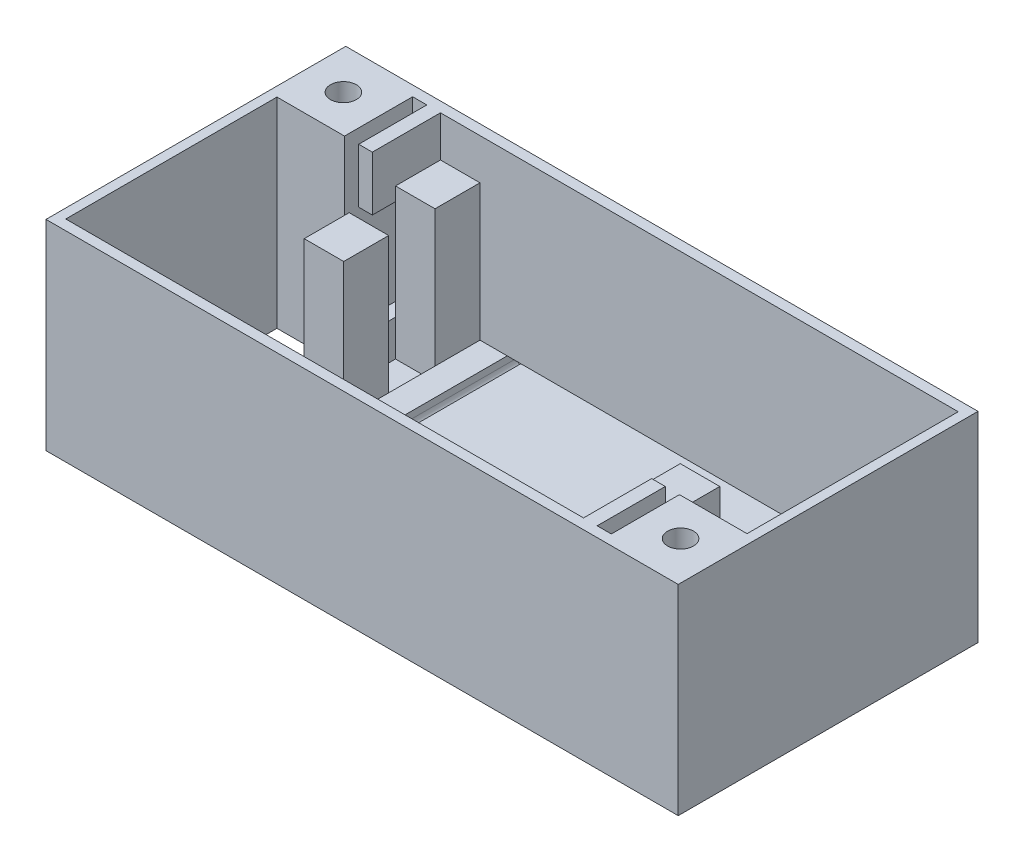
from build123d import *

# Parameters (mm, degrees)
ESBO_O1_W                = 46.4
ESBO_O1_H                = 22
ESBO_O1_W_2              = 45
ESBO_O1_H_2              = 20.5
RESSALTO_EXTRUS_O1_DEPTH = 14
ESBO_O2_W                = 46.4
ESBO_O2_H                = 22
RESSALTO_EXTRUS_O2_DEPTH = 0.7
ESBO_O3_W                = 2.9
ESBO_O3_H                = 3.3
RESSALTO_EXTRUS_O3_DEPTH = 11
ESBO_O4_W                = 4.95750459
ESBO_O4_H                = 14
ESBO_O4_W_2              = 1
ESBO_O4_H_2              = 2.660947199
ESBO_O4_H_3              = 4
RESSALTO_EXTRUS_O4_DEPTH = 5
ESBO_O5_W                = 1
ESBO_O5_H                = 2.660947199
ESBO_O5_W_2              = 4.96
ESBO_O5_H_2              = 14
RESSALTO_EXTRUS_O5_DEPTH = 5
RESSALTO_EXTRUS_O9_DEPTH = 1
ESBO_O15_W               = 4.95750459
ESBO_O15_H               = 5
ESBO_O15_W_2             = 4.96
CORTE_EXTRUS_O3_DEPTH    = 2.5
ESBO_O16_R               = 0.95
CORTE_EXTRUS_O4_DEPTH    = 4
CORTE_EXTRUS_O7_DEPTH    = 11
CORTE_EXTRUS_O8_DEPTH    = 11
CORTE_EXTRUS_O9_START    = -4
ESBO_O20_R               = 0.95
CORTE_EXTRUS_O9_DEPTH    = 4


with BuildPart() as part:
    # Esboço1 → Ressalto-extrusão1 (new body)
    with BuildSketch(Plane(origin=(0, 0, 0), x_dir=(1, 0, 0), z_dir=(0, 1, 0))):
        Rectangle(ESBO_O1_W, ESBO_O1_H)
        Rectangle(ESBO_O1_W_2, ESBO_O1_H_2, mode=Mode.SUBTRACT)
    extrude(amount=RESSALTO_EXTRUS_O1_DEPTH)

    # Esboço2 → Ressalto-extrusão2 (add)
    with BuildSketch(Plane(origin=(0, 0, 0), x_dir=(1, 0, 0), z_dir=(0, 1, 0))):
        Rectangle(ESBO_O2_W, ESBO_O2_H)
    extrude(amount=-RESSALTO_EXTRUS_O2_DEPTH)

    # Esboço3 → Ressalto-extrusão3 (add)
    with BuildSketch(Plane(origin=(0, 0, 0), x_dir=(1, 0, 0), z_dir=(0, 1, 0))):
        with Locations((-14.05, 1.9)):
            Rectangle(ESBO_O3_W, ESBO_O3_H)
        with Locations((-14.05, 8.6)):
            Rectangle(ESBO_O3_W, ESBO_O3_H)
        with Locations((14.05, -8.6)):
            Rectangle(ESBO_O3_W, ESBO_O3_H)
        with Locations((14.05, -1.9)):
            Rectangle(ESBO_O3_W, ESBO_O3_H)
    extrude(amount=RESSALTO_EXTRUS_O3_DEPTH)

    # Esboço4 → Ressalto-extrusão4 (add)
    with BuildSketch(Plane.XY.offset(-10.25)):
        with Locations((-20.021247705, 7)):
            Rectangle(ESBO_O4_W, ESBO_O4_H)
        with Locations((-16, 1.3304736)):
            Rectangle(ESBO_O4_W_2, ESBO_O4_H_2)
        with Locations((-16, 12)):
            Rectangle(ESBO_O4_W_2, ESBO_O4_H_3)
    extrude(amount=RESSALTO_EXTRUS_O4_DEPTH)

    # Esboço5 → Ressalto-extrusão5 (add)
    with BuildSketch(Plane(origin=(0, 0, 10.25), x_dir=(-1, 0, 0), z_dir=(0, 0, -1))):
        Polygon((-15.5, 14), (-16.5, 14), (-16.5, 10), (-15.5, 10), (-15.5, 11), align=None)
        with Locations((-16, 1.3304736)):
            Rectangle(ESBO_O5_W, ESBO_O5_H)
        with Locations((-20.02, 7)):
            Rectangle(ESBO_O5_W_2, ESBO_O5_H_2)
    extrude(amount=RESSALTO_EXTRUS_O5_DEPTH)

    # Esboço10 → Ressalto-extrusão9 (add)
    with BuildSketch(Plane(origin=(0, 0, 0), x_dir=(1, 0, 0), z_dir=(0, 1, 0))):
        Polygon((15.5, 0.25), (-12.6, 0.25), (-12.6, 10.25), (22.5, 10.25), (22.5, -10.25), (15.5, -10.25), align=None)
    extrude(amount=RESSALTO_EXTRUS_O9_DEPTH)

    # Esboço15 → Corte-extrusão3 (cut, symmetric)
    with BuildSketch(Plane.XZ.offset(0.7)):
        with Locations((-20.021247705, -2.75)):
            Rectangle(ESBO_O15_W, ESBO_O15_H)
        with Locations((20.02, 2.75)):
            Rectangle(ESBO_O15_W_2, ESBO_O15_H)
    extrude(amount=CORTE_EXTRUS_O3_DEPTH, both=True, mode=Mode.SUBTRACT)

    # Esboço16 → Corte-extrusão4 (cut)
    with BuildSketch(Plane.XZ.offset(0.7)):
        with Locations(Location((-20.372, -8, 0), (0, 0, 270))):
            Circle(ESBO_O16_R)
        with Locations(Location((20.372, 8, 0), (0, 0, 270))):
            Circle(ESBO_O16_R)
    extrude(amount=-CORTE_EXTRUS_O4_DEPTH, mode=Mode.SUBTRACT)

    # Esboço18 → Corte-extrusão7 (cut)
    with BuildSketch(Plane.XY.offset(-0.25)):
        with BuildLine():
            Line((-10.6, 0.5), (-10.6, 1))
            Line((-10.6, 1), (-9.6, 1))
            Line((-9.6, 1), (-9.6, 0.5))
            ThreePointArc((-9.6, 0.5), (-10.1, 0), (-10.6, 0.5))
        make_face()
    extrude(amount=-CORTE_EXTRUS_O7_DEPTH, mode=Mode.SUBTRACT)

    # Esboço19 → Corte-extrusão8 (cut)
    with BuildSketch(Plane(origin=(0, 0, -11), x_dir=(-1, 0, 0), z_dir=(0, 0, -1))):
        with BuildLine():
            Line((-10.6, 0.5), (-10.6, 1))
            Line((-10.6, 1), (-9.6, 1))
            Line((-9.6, 1), (-9.6, 0.5))
            ThreePointArc((-9.6, 0.5), (-10.1, 0), (-10.6, 0.5))
        make_face()
    extrude(amount=-CORTE_EXTRUS_O8_DEPTH, mode=Mode.SUBTRACT)

    # Esboço20 → Corte-extrusão9 (cut)
    with BuildSketch(Plane(origin=(0, 14, 0), x_dir=(1, 0, 0), z_dir=(0, 1, 0)).offset(CORTE_EXTRUS_O9_START)):
        with Locations(Location((20.372, -8, 0), (0, 0, 90))):
            Circle(ESBO_O20_R)
        with Locations(Location((-20.372, 8, 0), (0, 0, 90))):
            Circle(ESBO_O20_R)
    extrude(amount=CORTE_EXTRUS_O9_DEPTH, mode=Mode.SUBTRACT)


solid = part.part
